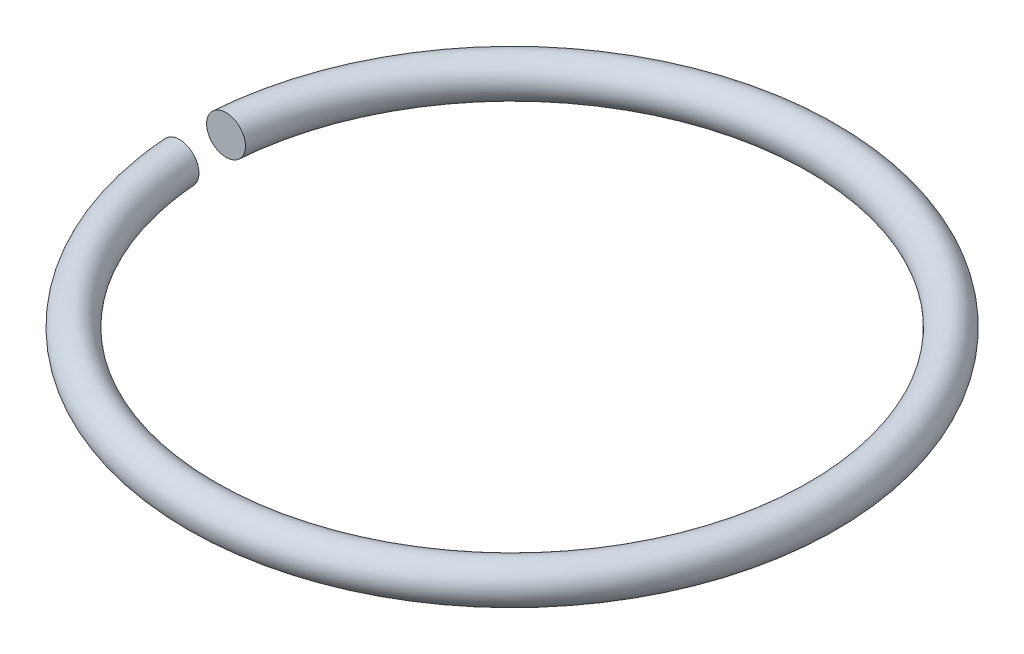
from build123d import *

# Parameters (mm, degrees)
SKETCH_1_R          = 1.25
SKETCH_2_W          = 8.762505604
SKETCH_2_H          = 3
CUT_EXTRUDE_1_DEPTH = 31.155845354


with BuildPart() as part:
    # Эскиз1 → Повернуть1 (revolve)
    with BuildSketch(Plane.XY, mode=Mode.PRIVATE) as revolve_1_sk:
        with Locations((-20, 1.25)):
            Circle(SKETCH_1_R)
    revolve(revolve_1_sk.sketch.rotate(Axis((0, 0, 0), (0, 1, 0)), 270), axis=Axis((0, 0, 0), (0, 1, 0)))

    # Эскиз2 → Вырез-Вытянуть1 (cut, through all)
    with BuildSketch(Plane(origin=(0, 0, 0), x_dir=(1, 0, 0), z_dir=(0, 1, 0))):
        with Locations((-20.458545692, 0)):
            Rectangle(SKETCH_2_W, SKETCH_2_H)
    extrude(amount=CUT_EXTRUDE_1_DEPTH, mode=Mode.SUBTRACT)


solid = part.part
